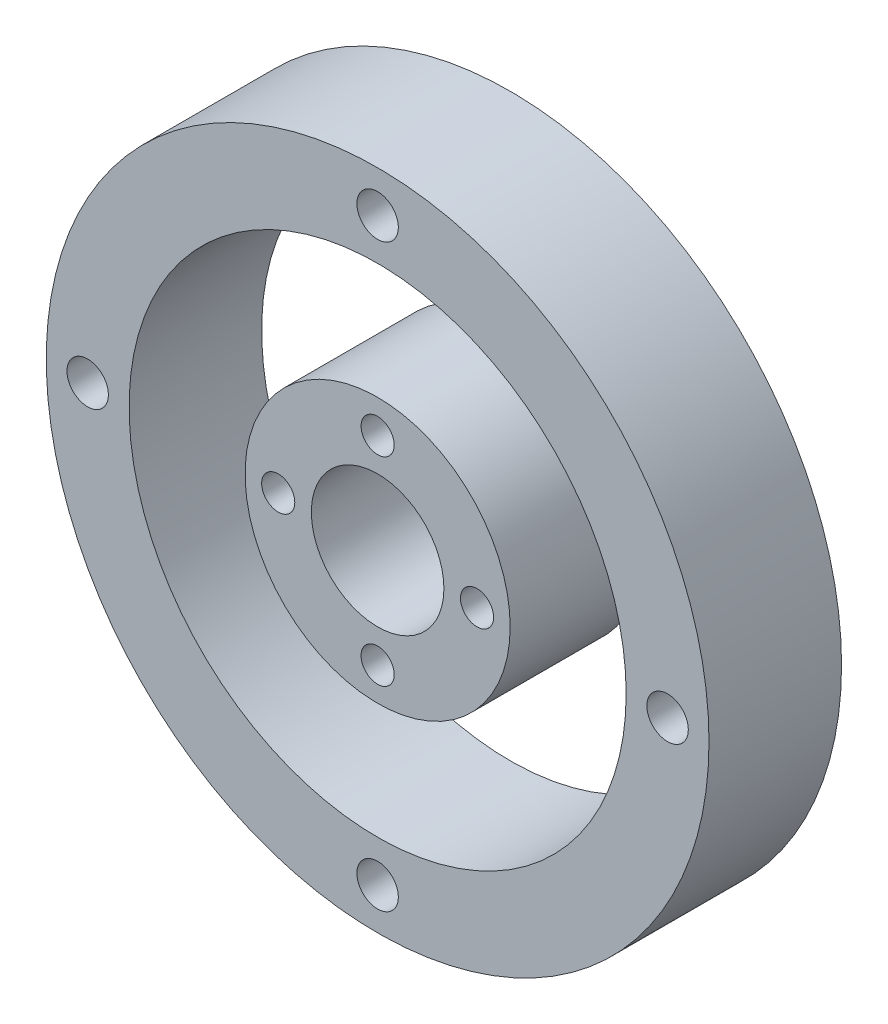
from build123d import *

# Parameters (mm, degrees)
SKETCH1_R             = 20
SKETCH1_R_2           = 1.25
SKETCH1_R_3           = 15
BOSS_EXTRUDE1_DEPTH   = 8
SKETCH1_R_4           = 8
SKETCH1_R_5           = 4
SKETCH1_R_6           = 1
BOSS_EXTRUDE1_2_DEPTH = 8


with BuildPart() as part:
    # Sketch1 → Boss-Extrude1 (new body)
    with BuildSketch(Plane.XY):
        Circle(SKETCH1_R)
        with Locations((0, 17.5)):
            Circle(SKETCH1_R_2, mode=Mode.SUBTRACT)
        with Locations((17.5, 0)):
            Circle(SKETCH1_R_2, mode=Mode.SUBTRACT)
        with Locations((0, -17.5)):
            Circle(SKETCH1_R_2, mode=Mode.SUBTRACT)
        with Locations((-17.5, 0)):
            Circle(SKETCH1_R_2, mode=Mode.SUBTRACT)
        Circle(SKETCH1_R_3, mode=Mode.SUBTRACT)
    extrude(amount=BOSS_EXTRUDE1_DEPTH)


with BuildPart() as body_2:
    # Sketch1 → Boss-Extrude1 2 (new body)
    with BuildSketch(Plane.XY):
        Circle(SKETCH1_R_4)
        Circle(SKETCH1_R_5, mode=Mode.SUBTRACT)
        with Locations((0, 6)):
            Circle(SKETCH1_R_6, mode=Mode.SUBTRACT)
        with Locations((6, 0)):
            Circle(SKETCH1_R_6, mode=Mode.SUBTRACT)
        with Locations((0, -6)):
            Circle(SKETCH1_R_6, mode=Mode.SUBTRACT)
        with Locations((-6, 0)):
            Circle(SKETCH1_R_6, mode=Mode.SUBTRACT)
    extrude(amount=BOSS_EXTRUDE1_2_DEPTH)


solid = Compound([part.part, body_2.part])
